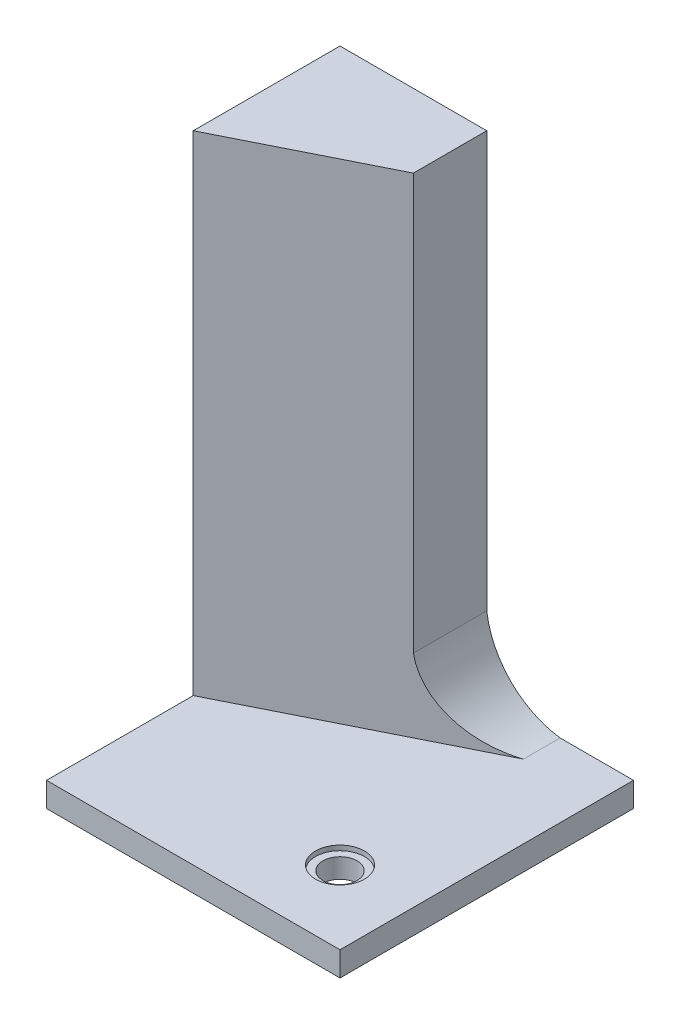
from build123d import *

# Parameters (mm, degrees)
SKETCH1_W           = 60
SKETCH1_H           = 60
BOSS_EXTRUDE1_DEPTH = 5
BOSS_EXTRUDE2_DEPTH = 100
SKETCH3_W           = 15
SKETCH3_H           = 15
BOSS_EXTRUDE3_DEPTH = 15
CUT_EXTRUDE1_DEPTH  = 119.11011811
SKETCH5_R           = 3.5
CUT_EXTRUDE2_DEPTH  = 109.627804912
SKETCH6_R           = 5
CUT_EXTRUDE3_DEPTH  = 1
CUT_EXTRUDE4_DEPTH  = 109.627804912


with BuildPart() as part:
    # Sketch1 → Boss-Extrude1 (new body)
    with BuildSketch(Plane(origin=(0, 0, 0), x_dir=(1, 0, 0), z_dir=(0, 1, 0))):
        Rectangle(SKETCH1_W, SKETCH1_H)
    extrude(amount=BOSS_EXTRUDE1_DEPTH)

    # Sketch2 → Boss-Extrude2 (add)
    with BuildSketch(Plane(origin=(0, 5, 0), x_dir=(1, 0, 0), z_dir=(0, 1, 0))):
        Polygon((-30, 30), (-30, 0), (0, 15), (0, 30), align=None)
    extrude(amount=BOSS_EXTRUDE2_DEPTH)

    # Sketch3 → Boss-Extrude3 (add)
    with BuildSketch(Plane(origin=(0, 5, 0), x_dir=(1, 0, 0), z_dir=(0, 1, 0))):
        with Locations((7.5, 22.5)):
            Rectangle(SKETCH3_W, SKETCH3_H)
    extrude(amount=BOSS_EXTRUDE3_DEPTH)

    # Sketch4 → Cut-Extrude1 (cut, through all)
    with BuildSketch(Plane.XY.offset(-15)):
        with BuildLine():
            Line((0, 20), (15, 20))
            Line((15, 20), (15, 5))
            ThreePointArc((15, 5), (4.934047308, 9.934047308), (0, 20))
        make_face()
    extrude(amount=-CUT_EXTRUDE1_DEPTH, mode=Mode.SUBTRACT)

    # Sketch5 → Cut-Extrude2 (cut, through all)
    with BuildSketch(Plane(origin=(0, 5, 0), x_dir=(1, 0, 0), z_dir=(0, 1, 0))):
        with Locations(Location((15, -15, 0), (0, 0, 270))):
            Circle(SKETCH5_R)
    extrude(amount=-CUT_EXTRUDE2_DEPTH, mode=Mode.SUBTRACT)

    # Sketch6 → Cut-Extrude3 (cut)
    with BuildSketch(Plane(origin=(0, 5, 0), x_dir=(1, 0, 0), z_dir=(0, 1, 0))):
        with Locations(Location((15, -15, 0), (0, 0, 270))):
            Circle(SKETCH6_R)
    extrude(amount=-CUT_EXTRUDE3_DEPTH, mode=Mode.SUBTRACT)

    # Sketch7 → Cut-Extrude4 (cut, through all)
    with BuildSketch(Plane(origin=(0, 5, 0), x_dir=(1, 0, 0), z_dir=(0, 1, 0))):
        Polygon((0, 15), (30, 30), (30, 7.119616729), (0, 7.119616729), align=None)
    extrude(amount=CUT_EXTRUDE4_DEPTH, mode=Mode.SUBTRACT)


solid = part.part
